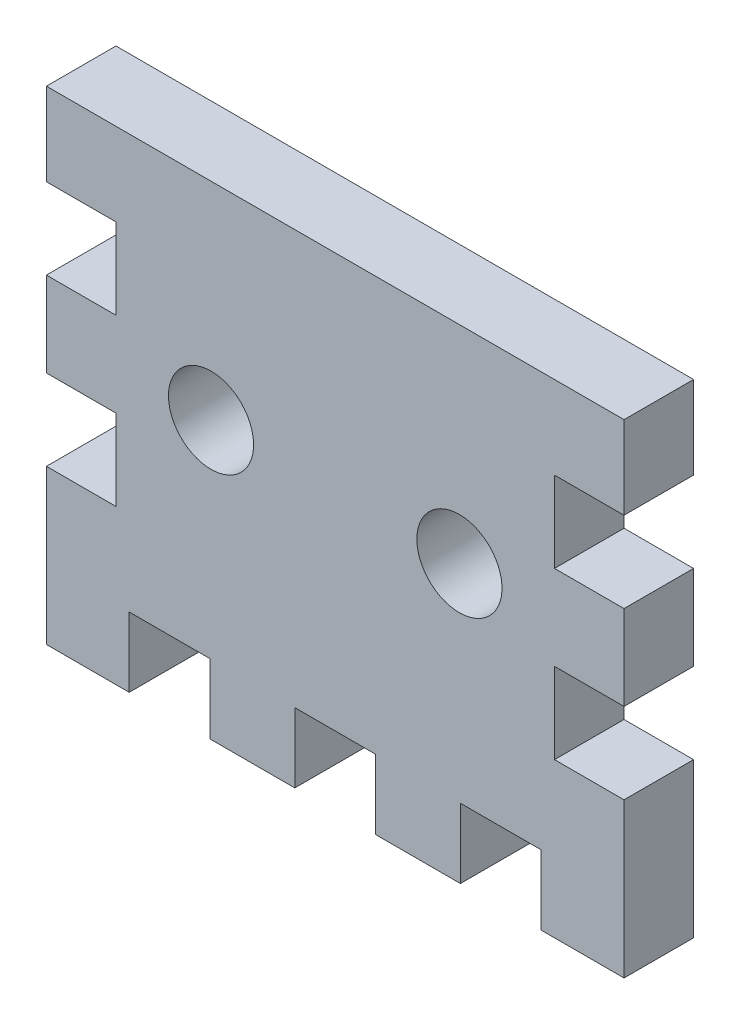
from build123d import *

# Parameters (mm, degrees)
SKETCH1_W                = 44.2976
SKETCH1_H                = 37.084
BOSS_EXTRUDE1_DEPTH      = 5.334
SKETCH2_W                = 6.1976
SKETCH2_H                = 5.334
CUT_EXTRUDE1_DEPTH       = 80.087198141
LPATTERN1_COUNT          = 3
LPATTERN1_PITCH          = 12.7
SKETCH3_W                = 5.334
SKETCH3_H                = 6.1976
CUT_EXTRUDE2_DEPTH       = 80.087198141
LPATTERN2_COUNT          = 2
LPATTERN2_PITCH          = 12.7
F_0_257_DIAMETER_HOLE1_D = 6.5278


with BuildPart() as part:
    # Sketch1 → Boss-Extrude1 (new body)
    with BuildSketch(Plane.XY):
        with Locations((50.0888, 13.208)):
            Rectangle(SKETCH1_W, SKETCH1_H)
    extrude(amount=-BOSS_EXTRUDE1_DEPTH)

    # Sketch2 → Cut-Extrude1 (cut, through all)
    with BuildSketch(Plane.XY):
        with Locations((62.7888, -2.667)):
            Rectangle(SKETCH2_W, SKETCH2_H)
    cut_extrude1 = extrude(amount=-CUT_EXTRUDE1_DEPTH, mode=Mode.SUBTRACT)

    # LPattern1: Cut-Extrude1 ×3
    with Locations(*[(-i * LPATTERN1_PITCH, 0, 0) for i in range(1, LPATTERN1_COUNT)]):
        add(cut_extrude1, mode=Mode.SUBTRACT)

    # Sketch3 → Cut-Extrude2 (cut, through all)
    with BuildSketch(Plane(origin=(0, 0, -5.334), x_dir=(-1, 0, 0), z_dir=(0, 0, -1))):
        with Locations((-69.5706, 9.6012)):
            Rectangle(SKETCH3_W, SKETCH3_H)
        with Locations((-30.607, 9.6012)):
            Rectangle(SKETCH3_W, SKETCH3_H)
    cut_extrude2 = extrude(amount=-CUT_EXTRUDE2_DEPTH, mode=Mode.SUBTRACT)

    # LPattern2: Cut-Extrude2 ×2
    with Locations(*[(0, i * LPATTERN2_PITCH, 0) for i in range(1, LPATTERN2_COUNT)]):
        add(cut_extrude2, mode=Mode.SUBTRACT)

    # F (0.257) Diameter Hole1 (through all)
    with Locations(Plane(origin=(0, 0, -5.334), x_dir=(-1, 0, 0), z_dir=(0, 0, -1))):
        with Locations((-59.6138, 15.875), (-40.5638, 15.875)):
            Hole(F_0_257_DIAMETER_HOLE1_D / 2)


solid = part.part
